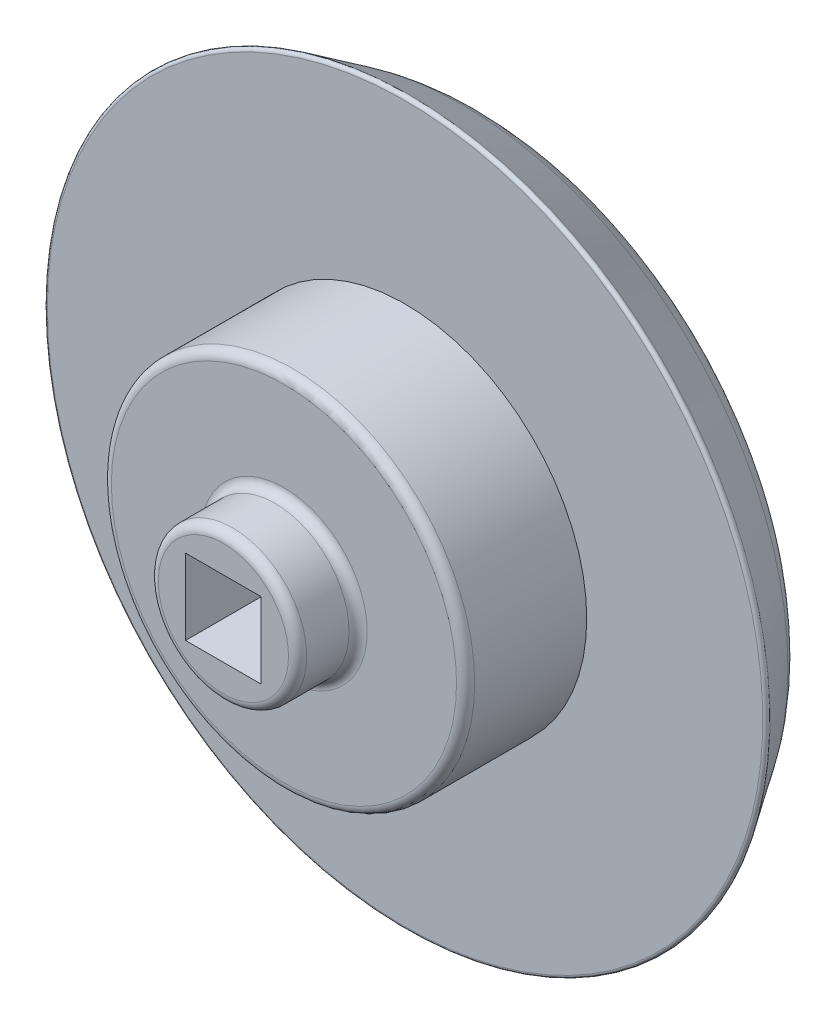
from build123d import *

# Parameters (mm, degrees)
SKETCH3_R           = 15.24
BOSS_EXTRUDE2_DEPTH = 10.16
SKETCH4_R           = 6.224057783
BOSS_EXTRUDE3_DEPTH = 5.08
SKETCH5_R           = 12.7
CUT_EXTRUDE1_DEPTH  = 5.08
FILLET1_R           = 6.096
FILLET2_R           = 0.762
FILLET3_R           = 0.254
SKETCH6_W           = 6.35
SKETCH6_H           = 6.35
CUT_EXTRUDE2_DEPTH  = 11


with BuildPart() as part:
    # Sketch1 → Revolve1 (revolve)
    with BuildSketch(Plane(origin=(0, 0, 0), x_dir=(1, 0, 0), z_dir=(0, 1, 0)), mode=Mode.PRIVATE) as revolve1_sk:
        Polygon((0, 5.683021583), (0, -1.936978417), (30.48, -1.936978417), (25.4, 5.683021583), align=None)
    revolve(revolve1_sk.sketch.rotate(Axis((0, 0, -5.683021583), (0, 0, 1)), 180), axis=Axis((0, 0, -5.683021583), (0, 0, 1)))

    # Sketch3 → Boss-Extrude2 (add)
    with BuildSketch(Plane.XY.offset(1.936978417)):
        Circle(SKETCH3_R)
    extrude(amount=BOSS_EXTRUDE2_DEPTH)

    # Sketch4 → Boss-Extrude3 (add)
    with BuildSketch(Plane.XY.offset(12.096978417)):
        Circle(SKETCH4_R)
    extrude(amount=BOSS_EXTRUDE3_DEPTH)

    # Sketch5 → Cut-Extrude1 (cut)
    with BuildSketch(Plane(origin=(0, 0, -5.683021583), x_dir=(-1, 0, 0), z_dir=(0, 0, -1))):
        Circle(SKETCH5_R)
    extrude(amount=-CUT_EXTRUDE1_DEPTH, mode=Mode.SUBTRACT)

    # Fillet1
    fillet1_edges = [part.edges().sort_by_distance(p)[0] for p in [
        (25.4, 0, -5.683021583),
    ]]
    fillet(fillet1_edges, radius=FILLET1_R)

    # Fillet2
    fillet2_edges = [part.edges().sort_by_distance(p)[0] for p in [
        (-15.24, 0, 12.096978417),
        (-6.224057783, 0, 12.096978417),
        (-6.224057783, 0, 17.176978417),
    ]]
    fillet(fillet2_edges, radius=FILLET2_R)

    # Fillet3
    fillet3_edges = [part.edges().sort_by_distance(p)[0] for p in [
        (30.48, 0, 1.936978417),
    ]]
    fillet(fillet3_edges, radius=FILLET3_R)

    # Sketch6 → Cut-Extrude2 (cut)
    with BuildSketch(Plane.XY.offset(17.176978417)):
        Rectangle(SKETCH6_W, SKETCH6_H)
    extrude(amount=-CUT_EXTRUDE2_DEPTH, mode=Mode.SUBTRACT)


solid = part.part
